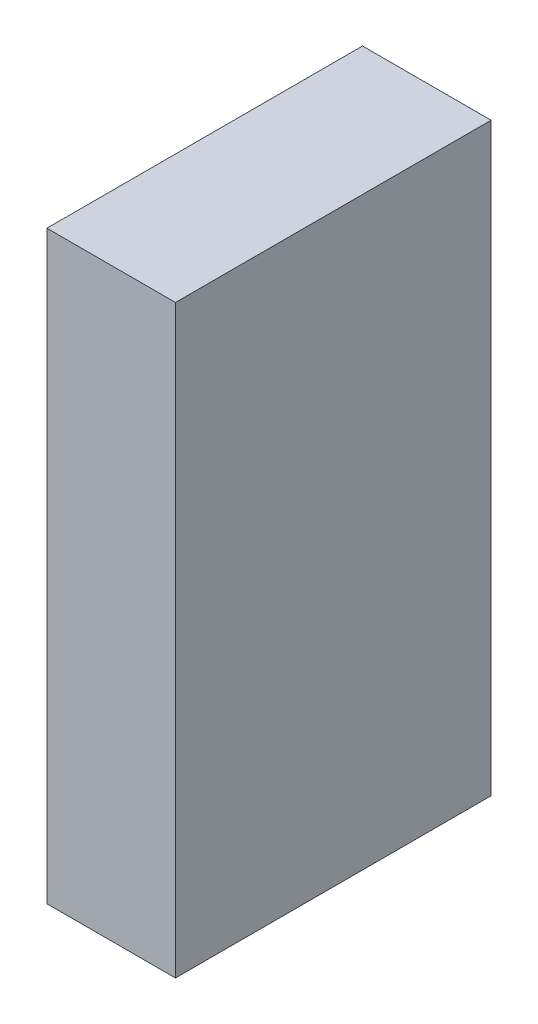
from build123d import *

# Parameters (mm, degrees)
SKETCH_1_W      = 22
SKETCH_1_H      = 54
SKETCH_1_W_2    = 18
SKETCH_1_H_2    = 50
EXTRUDE_1_DEPTH = 100
SKETCH_2_W      = 22
SKETCH_2_H      = 54
EXTRUDE_2_DEPTH = 0.1
SKETCH_3_R      = 2
EXTRUDE_3_DEPTH = 22


with BuildPart() as part:
    # 草图1 → 凸台-拉伸1 (new body)
    with BuildSketch(Plane(origin=(0, 0, 0), x_dir=(1, 0, 0), z_dir=(0, 1, 0))):
        Rectangle(SKETCH_1_W, SKETCH_1_H)
        Rectangle(SKETCH_1_W_2, SKETCH_1_H_2, mode=Mode.SUBTRACT)
    extrude(amount=EXTRUDE_1_DEPTH)

    # 草图2 → 凸台-拉伸2 (add)
    with BuildSketch(Plane(origin=(0, 100, 0), x_dir=(1, 0, 0), z_dir=(0, 1, 0))):
        Rectangle(SKETCH_2_W, SKETCH_2_H)
    extrude(amount=EXTRUDE_2_DEPTH)

    # 草图3 → 凸台-拉伸3 (add)
    with BuildSketch(Plane.ZY.offset(11)):
        with Locations((0, 64.062893105)):
            Circle(SKETCH_3_R)
        with Locations((0, 53.062893105)):
            Circle(SKETCH_3_R)
    extrude(amount=-EXTRUDE_3_DEPTH)


solid = part.part
